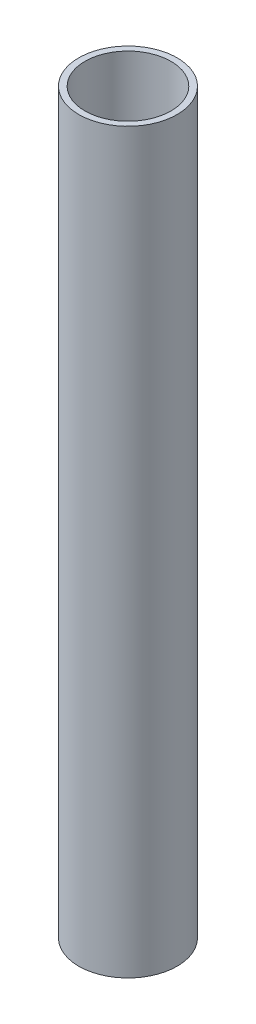
from build123d import *

# Parameters (mm, degrees)
SKETCH1_R           = 50.8
SKETCH1_R_2         = 44.45
BOSS_EXTRUDE1_DEPTH = 762


with BuildPart() as part:
    # Sketch1 → Boss-Extrude1 (new body)
    with BuildSketch(Plane(origin=(0, 0, 0), x_dir=(1, 0, 0), z_dir=(0, 1, 0))):
        with Locations(Location((0, 0, 0), (0, 0, 270))):
            Circle(SKETCH1_R)
        with Locations(Location((0, 0, 0), (0, 0, 270))):
            Circle(SKETCH1_R_2, mode=Mode.SUBTRACT)
    extrude(amount=BOSS_EXTRUDE1_DEPTH)


solid = part.part
